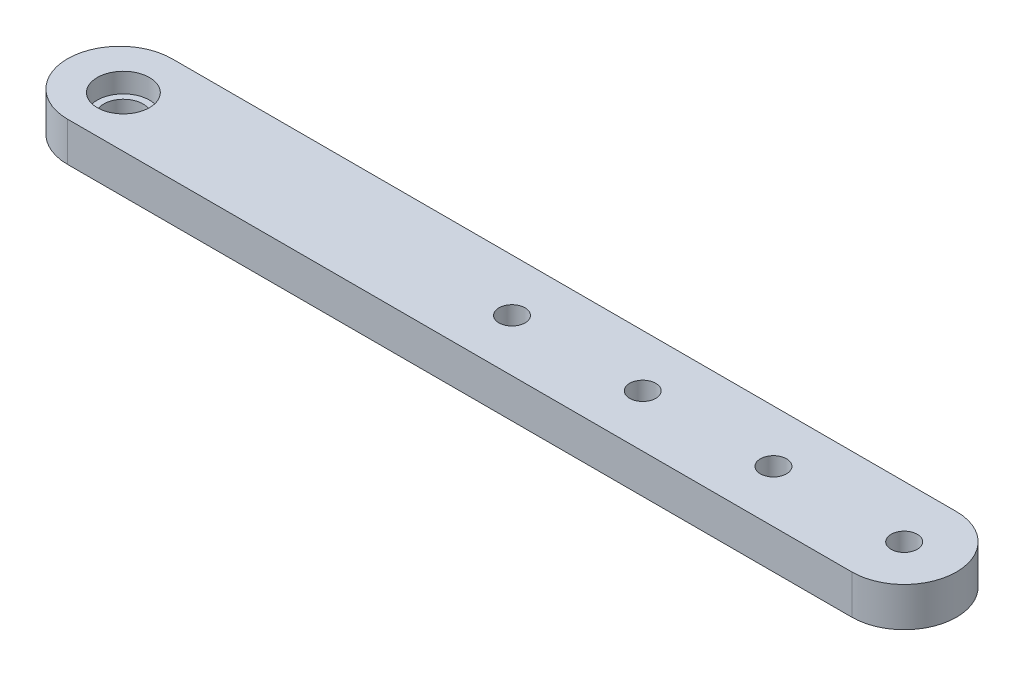
from build123d import *

# Parameters (mm, degrees)
SKETCH1_R           = 3
SKETCH1_R_2         = 2
BOSS_EXTRUDE1_DEPTH = 6
SKETCH3_R           = 4
CUT_EXTRUDE1_DEPTH  = 3


with BuildPart() as part:
    # Sketch1 → Boss-Extrude1 (new body)
    with BuildSketch(Plane(origin=(0, 0, 0), x_dir=(1, 0, 0), z_dir=(0, 1, 0))):
        with BuildLine():
            Line((-60, -8), (60, -8))
            ThreePointArc((60, -8), (68, 0), (60, 8))
            Line((60, 8), (-60, 8))
            ThreePointArc((-60, 8), (-68, 0), (-60, -8))
        make_face()
        with Locations(Location((-59.243309237, -0.211557176, 0), (0, 0, 270))):
            Circle(SKETCH1_R, mode=Mode.SUBTRACT)
        with Locations(Location((60, 0, 0), (0, 0, 270))):
            Circle(SKETCH1_R_2, mode=Mode.SUBTRACT)
        with Locations(Location((20, 0, 0), (0, 0, 270))):
            Circle(SKETCH1_R_2, mode=Mode.SUBTRACT)
        with Locations(Location((40, 0, 0), (0, 0, 270))):
            Circle(SKETCH1_R_2, mode=Mode.SUBTRACT)
        with Locations(Location((0, 0, 0), (0, 0, 270))):
            Circle(SKETCH1_R_2, mode=Mode.SUBTRACT)
    extrude(amount=BOSS_EXTRUDE1_DEPTH)

    # Sketch3 → Cut-Extrude1 (cut)
    with BuildSketch(Plane(origin=(0, 6, 0), x_dir=(1, 0, 0), z_dir=(0, 1, 0))):
        with Locations(Location((-59.243309237, -0.211557176, 0), (0, 0, 270))):
            Circle(SKETCH3_R)
    extrude(amount=-CUT_EXTRUDE1_DEPTH, mode=Mode.SUBTRACT)


solid = part.part
